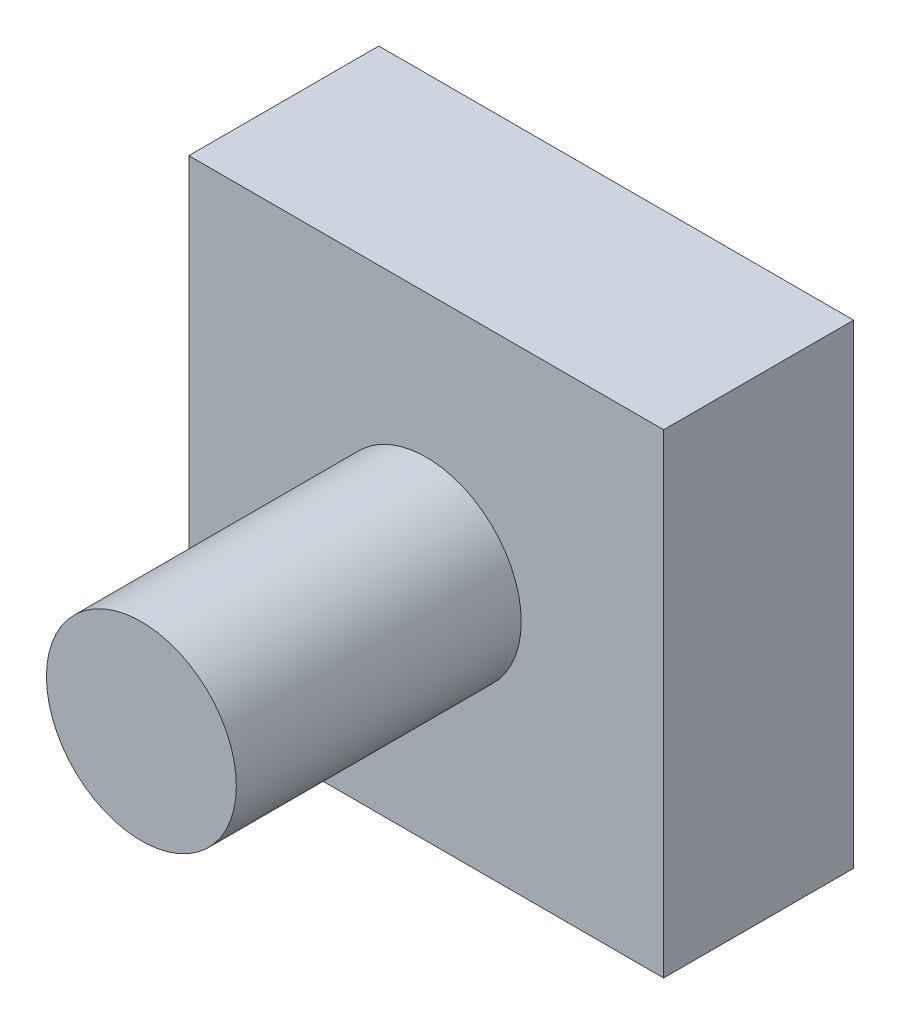
from build123d import *

# Parameters (mm, degrees)
SKETCH1_W           = 50
SKETCH1_H           = 50
BOSS_EXTRUDE1_DEPTH = 20
SKETCH2_R           = 10
BOSS_EXTRUDE2_DEPTH = 30


with BuildPart() as part:
    # Sketch1 → Boss-Extrude1 (new body)
    with BuildSketch(Plane.XY):
        Rectangle(SKETCH1_W, SKETCH1_H)
    extrude(amount=-BOSS_EXTRUDE1_DEPTH)

    # Sketch2 → Boss-Extrude2 (add)
    with BuildSketch(Plane.XY):
        Circle(SKETCH2_R)
    extrude(amount=BOSS_EXTRUDE2_DEPTH)


solid = part.part
